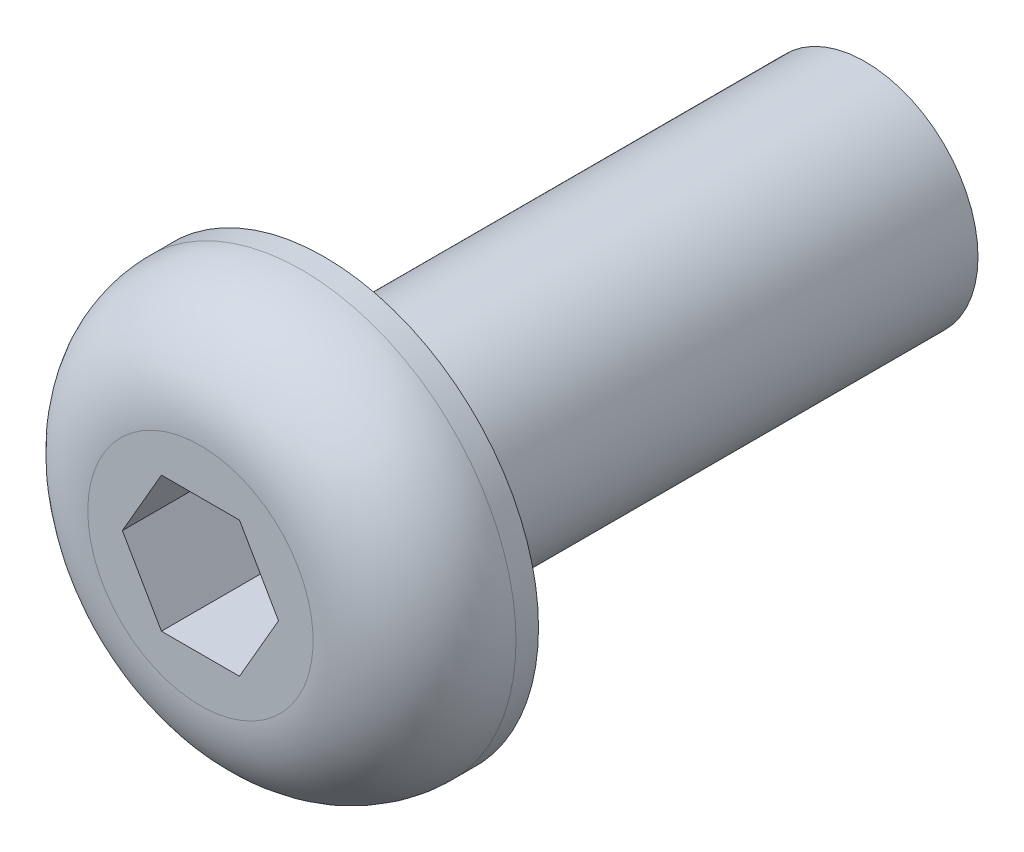
from build123d import *

# Parameters (mm, degrees)
SKETCH1_R          = 2.5
EXTRUDE1_DEPTH     = 12
CUT_EXTRUDE1_DEPTH = 2.5


with BuildPart() as part:
    # Sketch1 → Extrude1 (new body)
    with BuildSketch(Plane.XY):
        Circle(SKETCH1_R)
    extrude(amount=-EXTRUDE1_DEPTH)

    # Sketch2 → Revolve1 (revolve)
    with BuildSketch(Plane(origin=(0, 0, 0), x_dir=(0, 0, -1), z_dir=(1, 0, 0)), mode=Mode.PRIVATE) as revolve1_sk:
        with BuildLine():
            Line((0, 0), (0, 4.75))
            Line((0, 4.75), (-0.5, 4.75))
            ThreePointArc((-0.5, 4.75), (-2.090990258, 4.090990258), (-2.75, 2.5))
            Line((-2.75, 2.5), (-2.75, 0))
            Line((-2.75, 0), (0, 0))
        make_face()
    revolve(revolve1_sk.sketch.rotate(Axis((0, 0, 0), (0, 0, 1)), 90), axis=Axis((0, 0, 0), (0, 0, 1)))

    # Sketch3 → Cut-Extrude1 (cut)
    with BuildSketch(Plane.XY.offset(2.75)):
        Polygon((-0.866025404, 1.5), (-1.732050808, 0), (-0.866025404, -1.5), (0.866025404, -1.5), (1.732050808, 0), (0.866025404, 1.5), align=None)
    extrude(amount=-CUT_EXTRUDE1_DEPTH, mode=Mode.SUBTRACT)


solid = part.part
